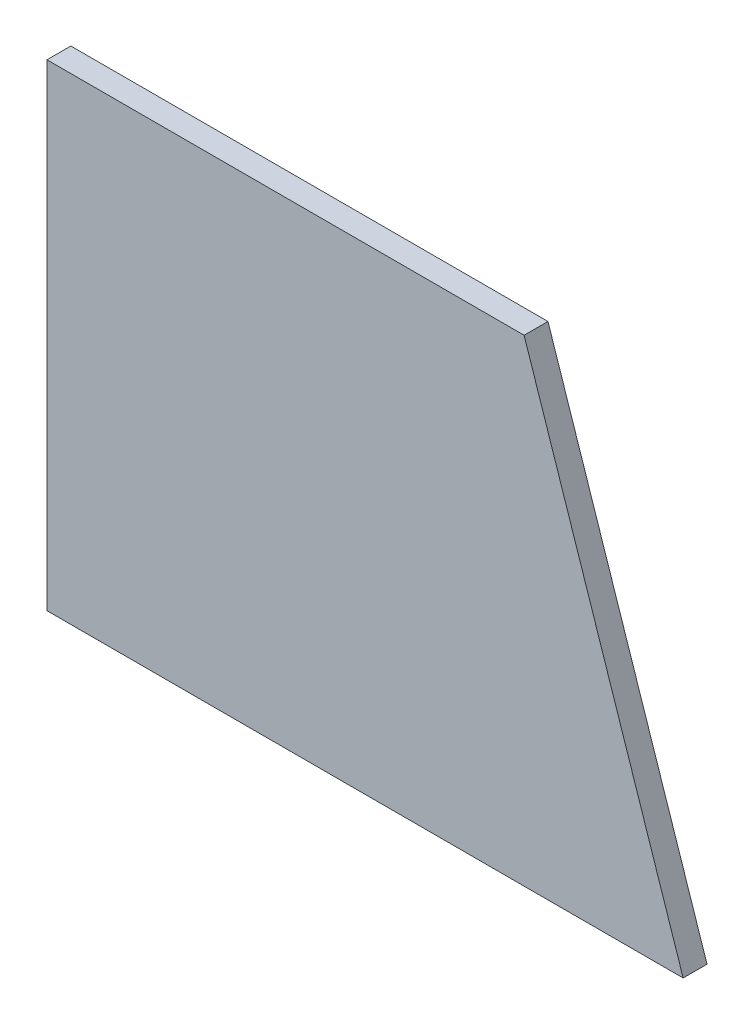
from build123d import *

# Parameters (mm, degrees)
BOSS_EXTRUDE3_DEPTH = 0.015


with BuildPart() as part:
    # Sketch1 → Boss-Extrude3 (new, symmetric)
    with BuildSketch(Plane.XY):
        Polygon((-0.273561122, -0.279919601), (-0.273561122, 0.320080399), (0.326438878, 0.320080399), (0.526438878, -0.279919601), align=None)
    extrude(amount=BOSS_EXTRUDE3_DEPTH, both=True)


solid = part.part
